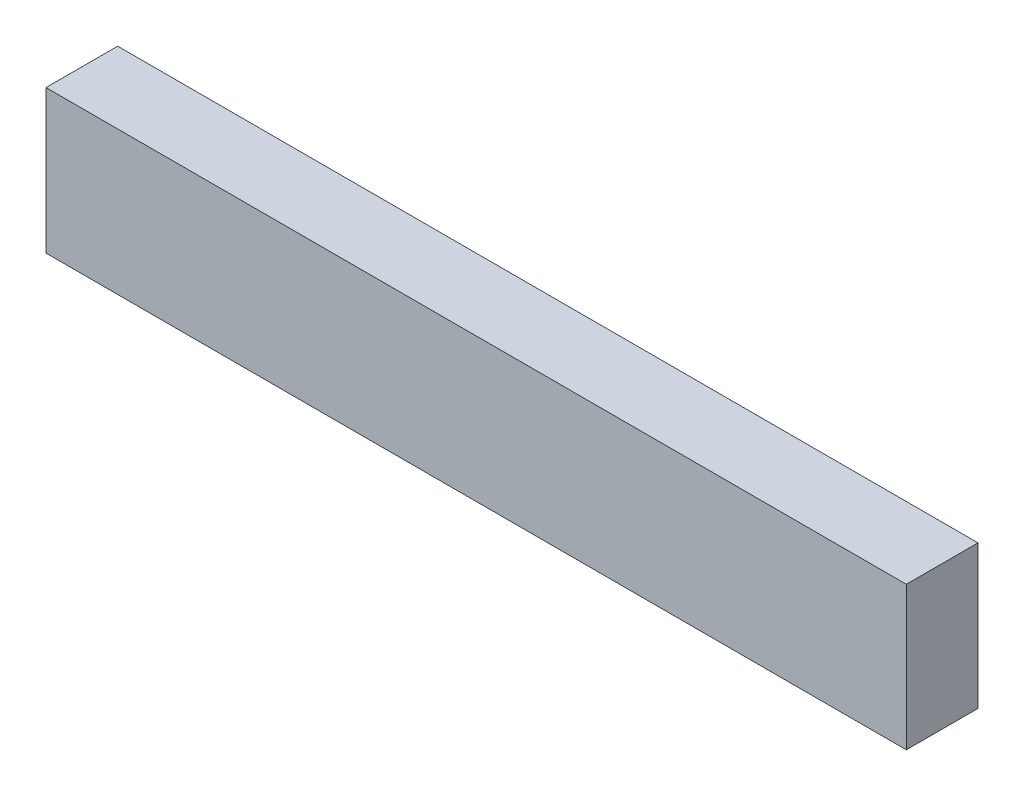
from build123d import *

# Parameters (mm, degrees)
SKETCH1_W           = 609.6
SKETCH1_H           = 101.6
BOSS_EXTRUDE1_DEPTH = 50.8


with BuildPart() as part:
    # Sketch1 → Boss-Extrude1 (new body)
    with BuildSketch(Plane.XY):
        Rectangle(SKETCH1_W, SKETCH1_H)
    extrude(amount=BOSS_EXTRUDE1_DEPTH)


solid = part.part
